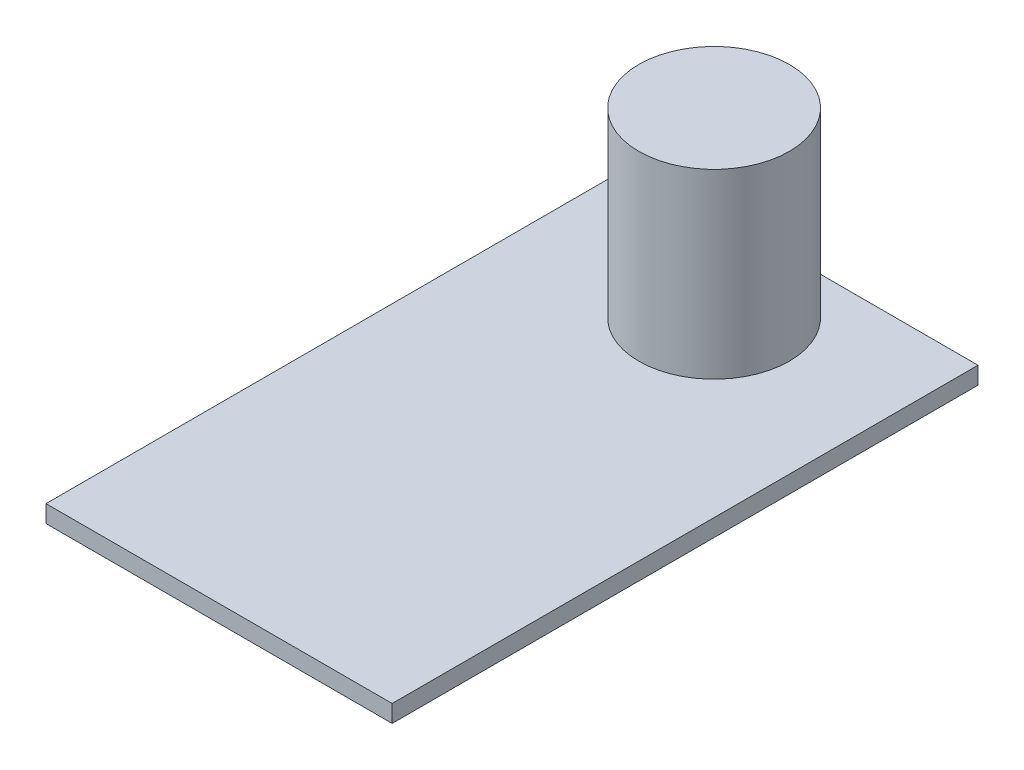
from build123d import *

# Parameters (mm, degrees)
SKETCH1_W           = 40
SKETCH1_H           = 67.7
BOSS_EXTRUDE1_DEPTH = 2
SKETCH2_R           = 8.7
BOSS_EXTRUDE2_DEPTH = 21


with BuildPart() as part:
    # Sketch1 → Boss-Extrude1 (new body)
    with BuildSketch(Plane(origin=(0, 0, 0), x_dir=(1, 0, 0), z_dir=(0, 1, 0))):
        with Locations((-20, 33.85)):
            Rectangle(SKETCH1_W, SKETCH1_H)
    extrude(amount=BOSS_EXTRUDE1_DEPTH)

    # Sketch2 → Boss-Extrude2 (add)
    with BuildSketch(Plane(origin=(0, 2, 0), x_dir=(1, 0, 0), z_dir=(0, 1, 0))):
        with Locations(Location((-20, 57.2, 0), (0, 0, 90))):
            Circle(SKETCH2_R)
    extrude(amount=BOSS_EXTRUDE2_DEPTH)


solid = part.part
